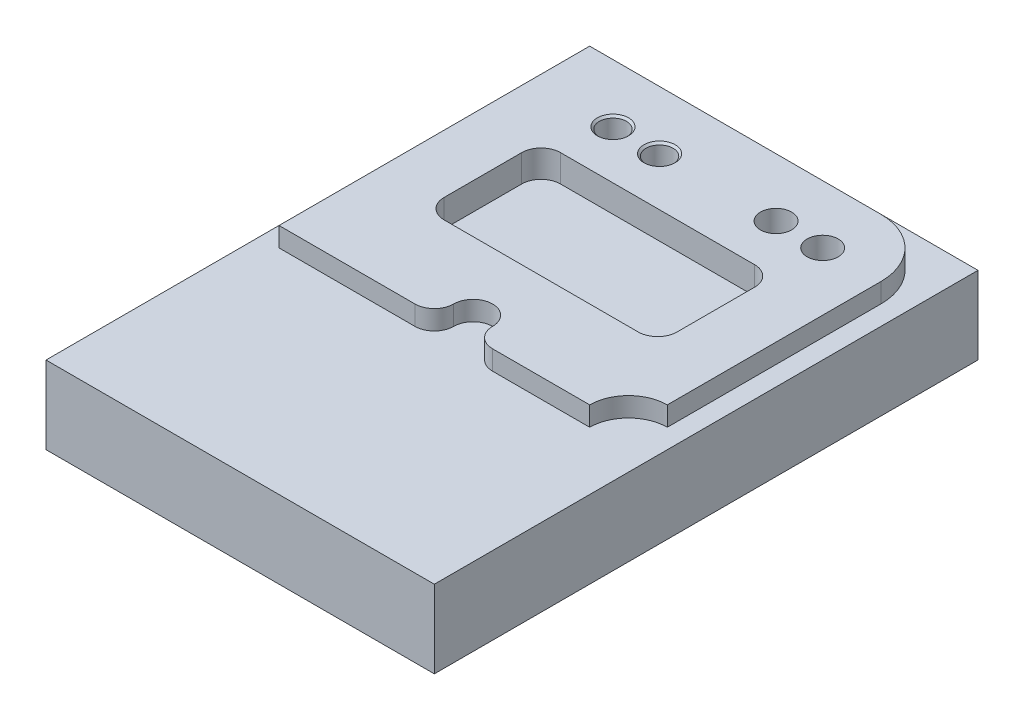
from build123d import *

# Parameters (mm, degrees)
SKETCH1_W                       = 100
SKETCH1_H                       = 140
BOSS_EXTRUDE1_DEPTH             = 25
SKETCH2_W                       = 100
SKETCH2_H                       = 55
CUT_EXTRUDE1_DEPTH              = 5
CUT_EXTRUDE2_DEPTH              = 5
SKETCH5_R                       = 4
CUT_EXTRUDE3_DEPTH              = 10
M8X1_0_TAPPED_HOLE1_D           = 7
M8X1_0_TAPPED_HOLE1_DEPTH       = 12.896987833
M8X1_0_TAPPED_HOLE1_CSINK_D     = 8.05
M8X1_0_TAPPED_HOLE1_CSINK_ANGLE = 90
M8X1_0_TAPPED_HOLE1_TIP         = 2.103012167
CUT_EXTRUDE4_DEPTH              = 7


with BuildPart() as part:
    # Sketch1 → Boss-Extrude1 (new body)
    with BuildSketch(Plane(origin=(0, 0, 0), x_dir=(1, 0, 0), z_dir=(0, 1, 0))):
        with Locations((-187.409638554, 78.222891566)):
            Rectangle(SKETCH1_W, SKETCH1_H)
    extrude(amount=BOSS_EXTRUDE1_DEPTH)

    # Sketch2 → Cut-Extrude1 (cut)
    with BuildSketch(Plane(origin=(0, 25, 0), x_dir=(1, 0, 0), z_dir=(0, 1, 0))):
        with Locations((-187.409638554, 35.722891566)):
            Rectangle(SKETCH2_W, SKETCH2_H)
    extrude(amount=-CUT_EXTRUDE1_DEPTH, mode=Mode.SUBTRACT)

    # Sketch3 → Cut-Extrude2 (cut)
    with BuildSketch(Plane(origin=(0, 25, 0), x_dir=(1, 0, 0), z_dir=(0, 1, 0))):
        with BuildLine():
            Line((-237.409638554, 148.222891566), (-237.409638554, 63.222891566))
            Line((-237.409638554, 63.222891566), (-232.409638554, 63.222891566))
            Line((-232.409638554, 63.222891566), (-232.409638554, 143.222891566))
            Line((-232.409638554, 143.222891566), (-157.409638554, 143.222891566))
            ThreePointArc((-157.409638554, 143.222891566), (-146.803036836, 138.829493284), (-142.409638554, 128.222891566))
            Line((-142.409638554, 128.222891566), (-142.409638554, 73.222891566))
            ThreePointArc((-142.409638554, 73.222891566), (-149.480706366, 70.293959378), (-152.409638554, 63.222891566))
            Line((-152.409638554, 63.222891566), (-137.409638554, 63.222891566))
            Line((-137.409638554, 63.222891566), (-137.409638554, 148.222891566))
            Line((-137.409638554, 148.222891566), (-237.409638554, 148.222891566))
        make_face()
        with BuildLine():
            ThreePointArc((-192.409638554, 68.222891566), (-193.874104648, 64.68735766), (-197.409638554, 63.222891566))
            Line((-197.409638554, 63.222891566), (-177.409638554, 63.222891566))
            ThreePointArc((-177.409638554, 63.222891566), (-180.94517246, 64.68735766), (-182.409638554, 68.222891566))
            ThreePointArc((-182.409638554, 68.222891566), (-187.409638554, 73.222891566), (-192.409638554, 68.222891566))
        make_face()
    extrude(amount=-CUT_EXTRUDE2_DEPTH, mode=Mode.SUBTRACT)

    # Sketch5 → Cut-Extrude3 (cut)
    with BuildSketch(Plane(origin=(0, 25, 0), x_dir=(1, 0, 0), z_dir=(0, 1, 0))):
        with BuildLine():
            ThreePointArc((-165.409638554, 128.222891566), (-169.409638554, 132.222891566), (-173.409638554, 128.222891566))
            Line((-173.409638554, 128.222891566), (-169.409638554, 128.222891566))
            Line((-169.409638554, 128.222891566), (-165.409638554, 128.222891566))
        make_face()
        with BuildLine():
            Line((-169.409638554, 128.222891566), (-173.409638554, 128.222891566))
            ThreePointArc((-173.409638554, 128.222891566), (-169.409638554, 124.222891566), (-165.409638554, 128.222891566))
            Line((-165.409638554, 128.222891566), (-169.409638554, 128.222891566))
        make_face()
        with Locations(Location((-157.409638554, 128.222891566, 0), (0, 0, 270))):
            Circle(SKETCH5_R)
    extrude(amount=-CUT_EXTRUDE3_DEPTH, mode=Mode.SUBTRACT)

    # M8x1.0 Tapped Hole1
    with Locations(Plane(origin=(-211.409638554, 25, -128.222891566), x_dir=(0, 0, 1), z_dir=(0, 1, 0))):
        with Locations((0, 0), (0, 12)):
            CounterSinkHole(M8X1_0_TAPPED_HOLE1_D / 2, M8X1_0_TAPPED_HOLE1_CSINK_D / 2, depth=M8X1_0_TAPPED_HOLE1_DEPTH, counter_sink_angle=M8X1_0_TAPPED_HOLE1_CSINK_ANGLE)
            with Locations((0, 0, -(M8X1_0_TAPPED_HOLE1_DEPTH + M8X1_0_TAPPED_HOLE1_TIP / 2))):  # 118° drill point
                Cone(0, M8X1_0_TAPPED_HOLE1_D / 2, M8X1_0_TAPPED_HOLE1_TIP, mode=Mode.SUBTRACT)

    # Sketch13 → Cut-Extrude4 (cut)
    with BuildSketch(Plane(origin=(0, 25, 0), x_dir=(1, 0, 0), z_dir=(0, 1, 0))):
        with BuildLine():
            Line((-162.409638554, 85.722891566), (-212.409638554, 85.722891566))
            ThreePointArc((-212.409638554, 85.722891566), (-215.94517246, 87.18735766), (-217.409638554, 90.722891566))
            Line((-217.409638554, 90.722891566), (-217.409638554, 110.722891566))
            ThreePointArc((-217.409638554, 110.722891566), (-215.94517246, 114.258425472), (-212.409638554, 115.722891566))
            Line((-212.409638554, 115.722891566), (-162.409638554, 115.722891566))
            ThreePointArc((-162.409638554, 115.722891566), (-158.874104648, 114.258425472), (-157.409638554, 110.722891566))
            Line((-157.409638554, 110.722891566), (-157.409638554, 90.722891566))
            ThreePointArc((-157.409638554, 90.722891566), (-158.874104648, 87.18735766), (-162.409638554, 85.722891566))
        make_face()
    extrude(amount=-CUT_EXTRUDE4_DEPTH, mode=Mode.SUBTRACT)


solid = part.part
